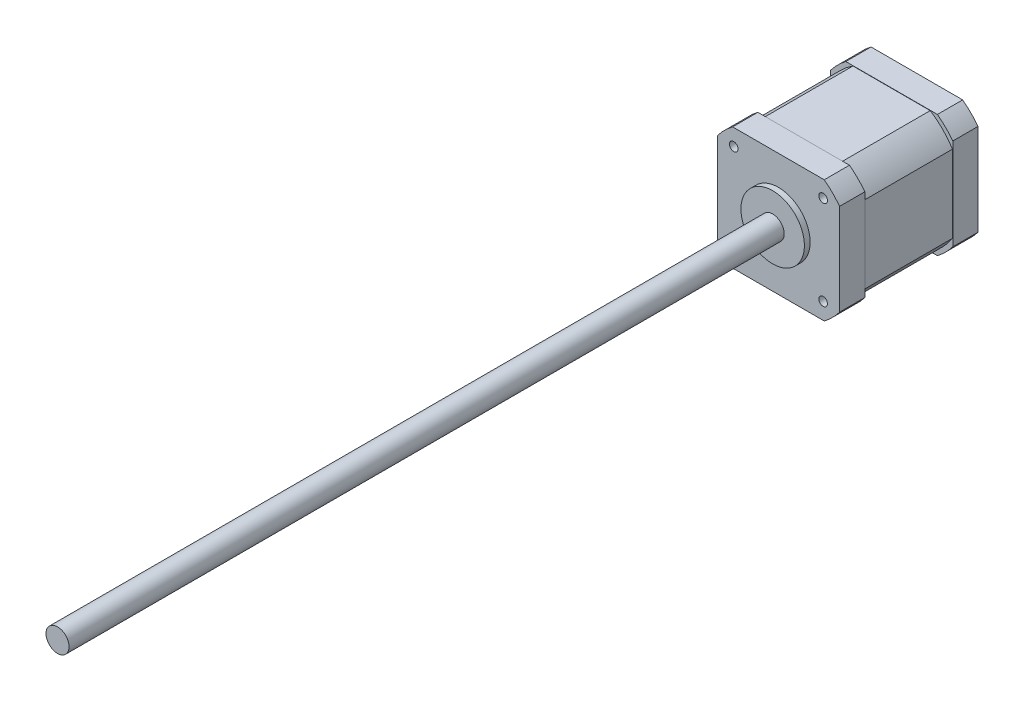
from build123d import *

# Parameters (mm, degrees)
SKETCH1_R                       = 4
BOSS_EXTRUDE1_DEPTH             = 250
SKETCH2_R                       = 11
BOSS_EXTRUDE2_DEPTH             = 2
SKETCH3_W                       = 42.418
SKETCH3_H                       = 42.418
BOSS_EXTRUDE3_DEPTH             = 48
CUT_EXTRUDE1_DEPTH              = 300.505664991
M3X0_5_TAPPED_HOLE1_D           = 2.5
M3X0_5_TAPPED_HOLE1_DEPTH       = 7.5
M3X0_5_TAPPED_HOLE1_CBORE_D     = 3
M3X0_5_TAPPED_HOLE1_CBORE_DEPTH = 6
M3X0_5_TAPPED_HOLE1_TIP         = 0.751075774
CUT_EXTRUDE3_DEPTH              = 15.25


with BuildPart() as part:
    # Sketch1 → Boss-Extrude1 (new body)
    with BuildSketch(Plane.XY):
        Circle(SKETCH1_R)
    extrude(amount=BOSS_EXTRUDE1_DEPTH)

    # Sketch2 → Boss-Extrude2 (add)
    with BuildSketch(Plane(origin=(0, 0, 0), x_dir=(-1, 0, 0), z_dir=(0, 0, -1))):
        Circle(SKETCH2_R)
    extrude(amount=-BOSS_EXTRUDE2_DEPTH)

    # Sketch3 → Boss-Extrude3 (add)
    with BuildSketch(Plane(origin=(0, 0, 0), x_dir=(-1, 0, 0), z_dir=(0, 0, -1))):
        Rectangle(SKETCH3_W, SKETCH3_H)
    extrude(amount=BOSS_EXTRUDE3_DEPTH)

    # Sketch4 → Cut-Extrude1 (cut, through all)
    with BuildSketch(Plane(origin=(0, 0, -48), x_dir=(-1, 0, 0), z_dir=(0, 0, -1))):
        with BuildLine():
            Line((-21.209, -15.887992919), (-21.209, -21.209))
            Line((-21.209, -21.209), (-15.887992919, -21.209))
            ThreePointArc((-15.887992919, -21.209), (-18.738329701, -18.738329701), (-21.209, -15.887992919))
        make_face()
        with BuildLine():
            Line((15.887992919, -21.209), (21.209, -21.209))
            Line((21.209, -21.209), (21.209, -15.887992919))
            ThreePointArc((21.209, -15.887992919), (18.738329701, -18.738329701), (15.887992919, -21.209))
        make_face()
        with BuildLine():
            Line((21.209, 15.887992919), (21.209, 21.209))
            Line((21.209, 21.209), (15.887992919, 21.209))
            ThreePointArc((15.887992919, 21.209), (18.738329701, 18.738329701), (21.209, 15.887992919))
        make_face()
        with BuildLine():
            Line((-15.887992919, 21.209), (-21.209, 21.209))
            Line((-21.209, 21.209), (-21.209, 15.887992919))
            ThreePointArc((-21.209, 15.887992919), (-18.738329701, 18.738329701), (-15.887992919, 21.209))
        make_face()
    extrude(amount=-CUT_EXTRUDE1_DEPTH, mode=Mode.SUBTRACT)

    # M3x0.5 Tapped Hole1
    with Locations(Plane.XY):
        with Locations((-15.5, 15.5), (-15.5, -15.5), (15.5, -15.5), (15.5, 15.5)):
            CounterBoreHole(M3X0_5_TAPPED_HOLE1_D / 2, M3X0_5_TAPPED_HOLE1_CBORE_D / 2, M3X0_5_TAPPED_HOLE1_CBORE_DEPTH, depth=M3X0_5_TAPPED_HOLE1_DEPTH)
            with Locations((0, 0, -(M3X0_5_TAPPED_HOLE1_DEPTH + M3X0_5_TAPPED_HOLE1_TIP / 2))):  # 118° drill point
                Cone(0, M3X0_5_TAPPED_HOLE1_D / 2, M3X0_5_TAPPED_HOLE1_TIP, mode=Mode.SUBTRACT)

    # Sketch8 → Cut-Extrude3 (cut, symmetric)
    with BuildSketch(Plane.XY.offset(-24)):
        with BuildLine():
            Line((15.887992919, 21.209), (-15.887992919, 21.209))
            ThreePointArc((-15.887992919, 21.209), (-18.738329701, 18.738329701), (-21.209, 15.887992919))
            Line((-21.209, 15.887992919), (-21.209, -15.887992919))
            ThreePointArc((-21.209, -15.887992919), (-18.738329701, -18.738329701), (-15.887992919, -21.209))
            Line((-15.887992919, -21.209), (15.887992919, -21.209))
            ThreePointArc((15.887992919, -21.209), (18.738329701, -18.738329701), (21.209, -15.887992919))
            Line((21.209, -15.887992919), (21.209, 15.887992919))
            ThreePointArc((21.209, 15.887992919), (18.738329701, 18.738329701), (15.887992919, 21.209))
        make_face()
        with BuildLine():
            Line((-13.394406258, 21.109), (13.394406258, 21.109))
            ThreePointArc((13.394406258, 21.109), (17.67766953, 17.67766953), (21.109, 13.394406258))
            Line((21.109, 13.394406258), (21.109, -13.394406258))
            ThreePointArc((21.109, -13.394406258), (17.67766953, -17.67766953), (13.394406258, -21.109))
            Line((13.394406258, -21.109), (-13.394406258, -21.109))
            ThreePointArc((-13.394406258, -21.109), (-17.67766953, -17.67766953), (-21.109, -13.394406258))
            Line((-21.109, -13.394406258), (-21.109, 13.394406258))
            ThreePointArc((-21.109, 13.394406258), (-17.67766953, 17.67766953), (-13.394406258, 21.109))
        make_face(mode=Mode.SUBTRACT)
    extrude(amount=CUT_EXTRUDE3_DEPTH, both=True, mode=Mode.SUBTRACT)


solid = part.part
